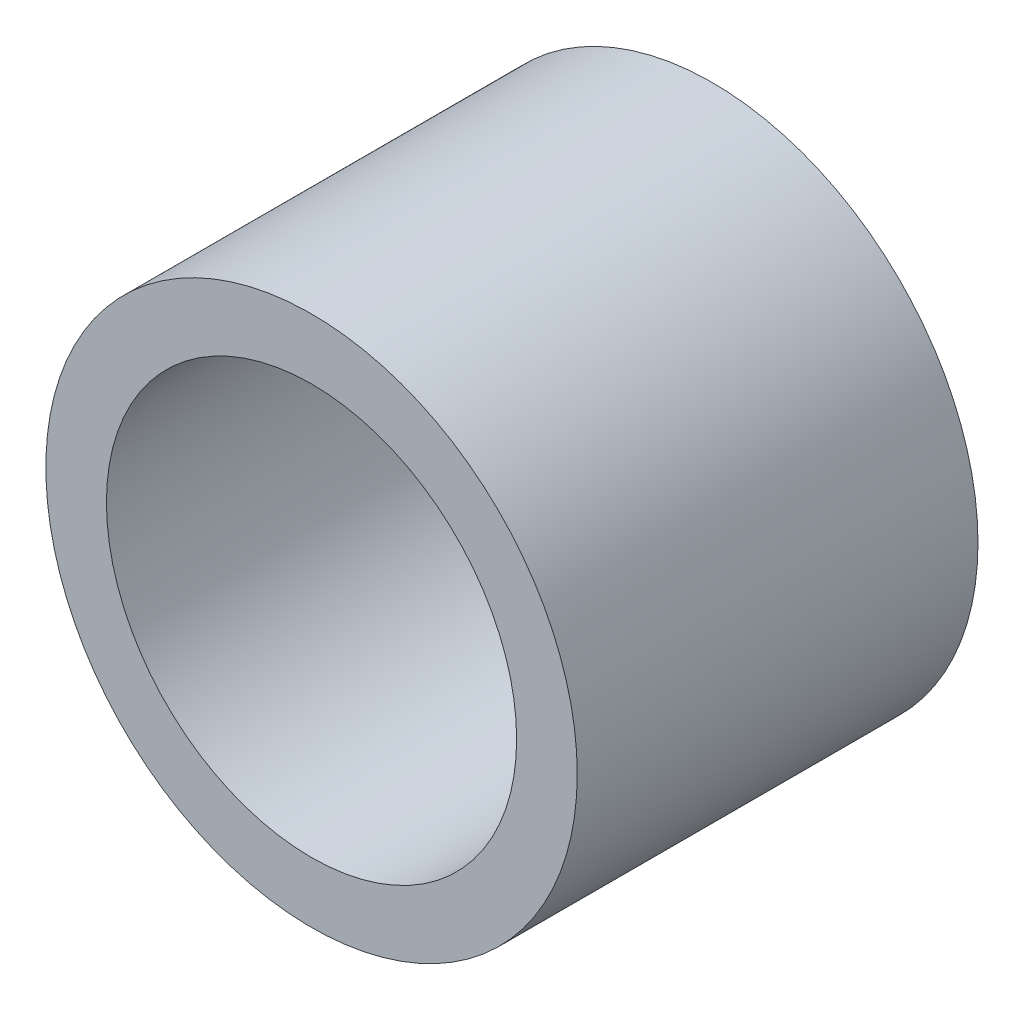
from build123d import *


with BuildPart() as part:
    # Sketch1 → Revolve2 (revolve)
    with BuildSketch(Plane(origin=(0, 0, 0), x_dir=(1, 0, 0), z_dir=(0, 1, 0))):
        with BuildLine():
            add(Edge.make_bspline(
                [(0, 29.4), (8.678885494, 28.55466352), (16.841248047, 25.4)],
                knots=[0, 0, 0, 1, 1, 1], degree=2))
            Line((16.841248047, 25.4), (16.841248047, 0))
            Line((16.841248047, 0), (13, 0))
            Line((13, 0), (13, 23.781740617))
            add(Edge.make_bspline(
                [(0, 28.989500287), (6.524006778, 26.445552373), (13, 23.781740617)],
                knots=[0, 0, 0, 1, 1, 1], degree=2))
            Line((0, 28.989500287), (0, 29.4))
        make_face()
    revolve(axis=Axis((0, 0, 0), (0, 0, -1)))


solid = part.part
